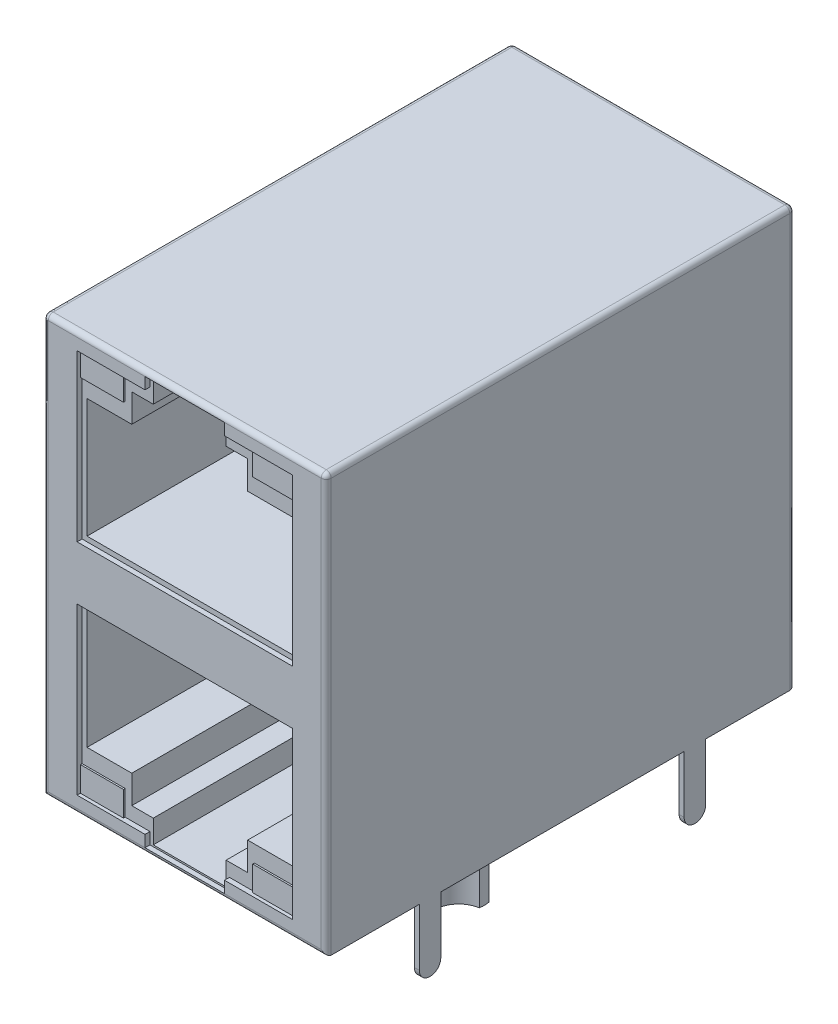
from build123d import *

# Parameters (mm, degrees)
SKETCH_1_W          = 17.09
SKETCH_1_H          = 28.3
EXTRUDE_1_DEPTH     = 25.25
EXTRUDE_2_DEPTH     = 0.3
EXTRUDE_START       = -0.3
EXTRUDE_3_DEPTH     = 0.3
EXTRUDE_4_DEPTH     = 3.3
SKETCH_7_R          = 0.25
EXTRUDE_5_DEPTH     = 3.15
FILLET_1_R          = 0.3
CUT_EXTRUDE_1_DEPTH = 10
EXTRUDE_6_DEPTH     = 9.7
SKETCH_10_W         = 2.6
SKETCH_10_H         = 1.5
EXTRUDE_7_DEPTH     = 0.1
EXTRUDE_8_DEPTH     = 9.7


with BuildPart() as part:
    # 草图1 → 凸台-拉伸1 (new body)
    with BuildSketch(Plane(origin=(0, 0, 0), x_dir=(1, 0, 0), z_dir=(0, 1, 0))):
        with Locations((8.545, 14.15)):
            Rectangle(SKETCH_1_W, SKETCH_1_H)
    extrude(amount=EXTRUDE_1_DEPTH)

    # 草图2 → 凸台-拉伸2 (add)
    with BuildSketch(Plane(origin=(17.09, 0, 0), x_dir=(0, 0, -1), z_dir=(1, 0, 0))):
        with BuildLine():
            Line((21.62, 0), (21.62, -3.45))
            ThreePointArc((21.62, -3.45), (22.27, -4.1), (22.92, -3.45))
            Line((22.92, -3.45), (22.92, 0))
            Line((22.92, 0), (21.62, 0))
        make_face()
        with BuildLine():
            Line((6.92, -3.45), (6.92, 0))
            Line((6.92, 0), (5.62, 0))
            Line((5.62, 0), (5.62, -3.45))
            ThreePointArc((5.62, -3.45), (6.27, -4.1), (6.92, -3.45))
        make_face()
    extrude(amount=-EXTRUDE_2_DEPTH)

    # 草图4 → 凸台-拉伸3 (add)
    with BuildSketch(Plane.ZY.offset(EXTRUDE_START)):
        with BuildLine():
            Line((-5.62, -3.45), (-5.62, 0))
            Line((-5.62, 0), (-6.92, 0))
            Line((-6.92, 0), (-6.92, -3.45))
            ThreePointArc((-6.92, -3.45), (-6.27, -4.1), (-5.62, -3.45))
        make_face()
        with BuildLine():
            Line((-25.68, -3.45), (-25.68, 0))
            Line((-25.68, 0), (-26.98, 0))
            Line((-26.98, 0), (-26.98, -3.45))
            ThreePointArc((-26.98, -3.45), (-26.33, -4.1), (-25.68, -3.45))
        make_face()
    extrude(amount=EXTRUDE_3_DEPTH)

    # 草图5 → 凸台-拉伸4 (add)
    with BuildSketch(Plane.XZ):
        with BuildLine():
            ThreePointArc((1.306965866, -10.552133668), (1.28, -10.84), (1.306965866, -11.127866332))
            ThreePointArc((1.306965866, -11.127866332), (2.122893219, -11.547106781), (2.542133668, -12.363034134))
            ThreePointArc((2.542133668, -12.363034134), (2.83, -12.39), (3.117866332, -12.363034134))
            ThreePointArc((3.117866332, -12.363034134), (3.537106781, -11.547106781), (4.353034134, -11.127866332))
            ThreePointArc((4.353034134, -11.127866332), (4.38, -10.84), (4.353034134, -10.552133668))
            ThreePointArc((4.353034134, -10.552133668), (3.537106781, -10.132893219), (3.117866332, -9.316965866))
            ThreePointArc((3.117866332, -9.316965866), (2.83, -9.29), (2.542133668, -9.316965866))
            ThreePointArc((2.542133668, -9.316965866), (2.122893219, -10.132893219), (1.306965866, -10.552133668))
        make_face()
        with BuildLine():
            ThreePointArc((14.547866332, -12.363034134), (14.26, -12.39), (13.972133668, -12.363034134))
            ThreePointArc((13.972133668, -12.363034134), (13.552893219, -11.547106781), (12.736965866, -11.127866332))
            ThreePointArc((12.736965866, -11.127866332), (12.71, -10.84), (12.736965866, -10.552133668))
            ThreePointArc((12.736965866, -10.552133668), (13.552893219, -10.132893219), (13.972133668, -9.316965866))
            ThreePointArc((13.972133668, -9.316965866), (14.26, -9.29), (14.547866332, -9.316965866))
            ThreePointArc((14.547866332, -9.316965866), (14.967106781, -10.132893219), (15.783034134, -10.552133668))
            ThreePointArc((15.783034134, -10.552133668), (15.81, -10.84), (15.783034134, -11.127866332))
            ThreePointArc((15.783034134, -11.127866332), (14.967106781, -11.547106781), (14.547866332, -12.363034134))
        make_face()
    extrude(amount=EXTRUDE_4_DEPTH)

    # 草图7 → 凸台-拉伸5 (add)
    with BuildSketch(Plane.XZ):
        with Locations(Location((5.5, -13.65, 0), (0, 0, 90))):
            Circle(SKETCH_7_R)
        with Locations(Location((7.53, -13.65, 0), (0, 0, 90))):
            Circle(SKETCH_7_R)
        with Locations(Location((5.5, -11.85, 0), (0, 0, 90))):
            Circle(SKETCH_7_R)
        with Locations(Location((7.53, -11.85, 0), (0, 0, 90))):
            Circle(SKETCH_7_R)
        with Locations(Location((9.56, -11.85, 0), (0, 0, 90))):
            Circle(SKETCH_7_R)
        with Locations(Location((11.59, -11.85, 0), (0, 0, 90))):
            Circle(SKETCH_7_R)
        with Locations(Location((9.56, -13.65, 0), (0, 0, 90))):
            Circle(SKETCH_7_R)
        with Locations(Location((11.59, -13.65, 0), (0, 0, 90))):
            Circle(SKETCH_7_R)
        with Locations(Location((5.245, -15.54, 0), (0, 0, 90))):
            Circle(SKETCH_7_R)
        with Locations(Location((6.515, -16.81, 0), (0, 0, 90))):
            Circle(SKETCH_7_R)
        with Locations(Location((5.245, -18.077907843, 0), (0, 0, 90))):
            Circle(SKETCH_7_R)
        with Locations(Location((6.515, -19.347907843, 0), (0, 0, 90))):
            Circle(SKETCH_7_R)
        with Locations(Location((5.245, -20.615815685, 0), (0, 0, 90))):
            Circle(SKETCH_7_R)
        with Locations(Location((6.515, -21.885815685, 0), (0, 0, 90))):
            Circle(SKETCH_7_R)
        with Locations(Location((6.515, -24.423723528, 0), (0, 0, 90))):
            Circle(SKETCH_7_R)
        with Locations(Location((5.245, -25.69163137, 0), (0, 0, 90))):
            Circle(SKETCH_7_R)
        with Locations(Location((5.245, -23.153723528, 0), (0, 0, 90))):
            Circle(SKETCH_7_R)
        with Locations(Location((6.515, -26.96163137, 0), (0, 0, 90))):
            Circle(SKETCH_7_R)
        with Locations(Location((10.575, -26.96163137, 0), (0, 0, 90))):
            Circle(SKETCH_7_R)
        with Locations(Location((11.845, -23.153723528, 0), (0, 0, 90))):
            Circle(SKETCH_7_R)
        with Locations(Location((11.845, -25.69163137, 0), (0, 0, 90))):
            Circle(SKETCH_7_R)
        with Locations(Location((10.575, -24.423723528, 0), (0, 0, 90))):
            Circle(SKETCH_7_R)
        with Locations(Location((10.575, -21.885815685, 0), (0, 0, 90))):
            Circle(SKETCH_7_R)
        with Locations(Location((11.845, -20.615815685, 0), (0, 0, 90))):
            Circle(SKETCH_7_R)
        with Locations(Location((10.575, -19.347907843, 0), (0, 0, 90))):
            Circle(SKETCH_7_R)
        with Locations(Location((11.845, -18.077907843, 0), (0, 0, 90))):
            Circle(SKETCH_7_R)
        with Locations(Location((10.575, -16.81, 0), (0, 0, 90))):
            Circle(SKETCH_7_R)
        with Locations(Location((11.845, -15.54, 0), (0, 0, 90))):
            Circle(SKETCH_7_R)
    extrude(amount=EXTRUDE_5_DEPTH)

    # 圆角1
    fillet_1_edges = [part.edges().sort_by_distance(p)[0] for p in [
        (17.09, 25.25, -14.15),
        (8.545, 25.25, -28.3),
        (0, 25.25, -14.15),
        (8.545, 0, 0),
        (0, 12.625, -28.3),
        (17.09, 12.625, -28.3),
        (17.09, 12.625, 0),
        (0, 12.625, 0),
        (8.545, 25.25, 0),
    ]]
    fillet(fillet_1_edges, radius=FILLET_1_R)

    # 草图8 → 切除-拉伸1 (cut)
    with BuildSketch(Plane.XY):
        Polygon((15.045, 14.25), (2.045, 14.25), (2.045, 24.25), (6.145, 24.25), (6.145, 24.95), (10.945, 24.95), (10.945, 24.25), (15.045, 24.25), align=None)
        Polygon((10.945, 0.3), (6.145, 0.3), (6.145, 1), (2.045, 1), (2.045, 11), (15.045, 11), (15.045, 1), (10.945, 1), align=None)
    extrude(amount=-CUT_EXTRUDE_1_DEPTH, mode=Mode.SUBTRACT)

    # 草图9 → 凸台-拉伸6 (add)
    with BuildSketch(Plane.XY.offset(-10)):
        Polygon((2.045, 24.25), (2.045, 21.75), (5.045, 21.75), (5.045, 23.45), (6.345, 23.45), (6.345, 24.85), (10.745, 24.85), (10.745, 23.45), (12.045, 23.45), (12.045, 21.75), (15.045, 21.75), (15.045, 24.25), (10.945, 24.25), (10.945, 24.95), (6.145, 24.95), (6.145, 24.25), align=None)
        Polygon((15.045, 1), (15.045, 3.5), (12.045, 3.5), (12.045, 1.8), (10.745, 1.8), (10.745, 0.4), (6.345, 0.4), (6.345, 1.8), (5.045, 1.8), (5.045, 3.5), (2.045, 3.5), (2.045, 1), (6.145, 1), (6.145, 0.3), (10.945, 0.3), (10.945, 1), align=None)
    extrude(amount=EXTRUDE_6_DEPTH)

    # 草图10 → 凸台-拉伸7 (add)
    with BuildSketch(Plane.XY.offset(-0.3)):
        with Locations((3.345, 23.5)):
            Rectangle(SKETCH_10_W, SKETCH_10_H)
        with Locations((13.745, 23.5)):
            Rectangle(SKETCH_10_W, SKETCH_10_H)
        with Locations((13.745, 1.75)):
            Rectangle(SKETCH_10_W, SKETCH_10_H)
        with Locations((3.345, 1.75)):
            Rectangle(SKETCH_10_W, SKETCH_10_H)
    extrude(amount=EXTRUDE_7_DEPTH)

    # 草图11 → 凸台-拉伸8 (add)
    with BuildSketch(Plane.XY.offset(-10)):
        Polygon((15.045, 3.5), (15.045, 11), (2.045, 11), (2.045, 3.5), (2.345, 3.5), (2.345, 10.7), (14.745, 10.7), (14.745, 3.5), align=None)
        Polygon((14.745, 21.75), (15.045, 21.75), (15.045, 14.25), (2.045, 14.25), (2.045, 21.75), (2.345, 21.75), (2.345, 14.55), (14.745, 14.55), align=None)
    extrude(amount=EXTRUDE_8_DEPTH)


solid = part.part
